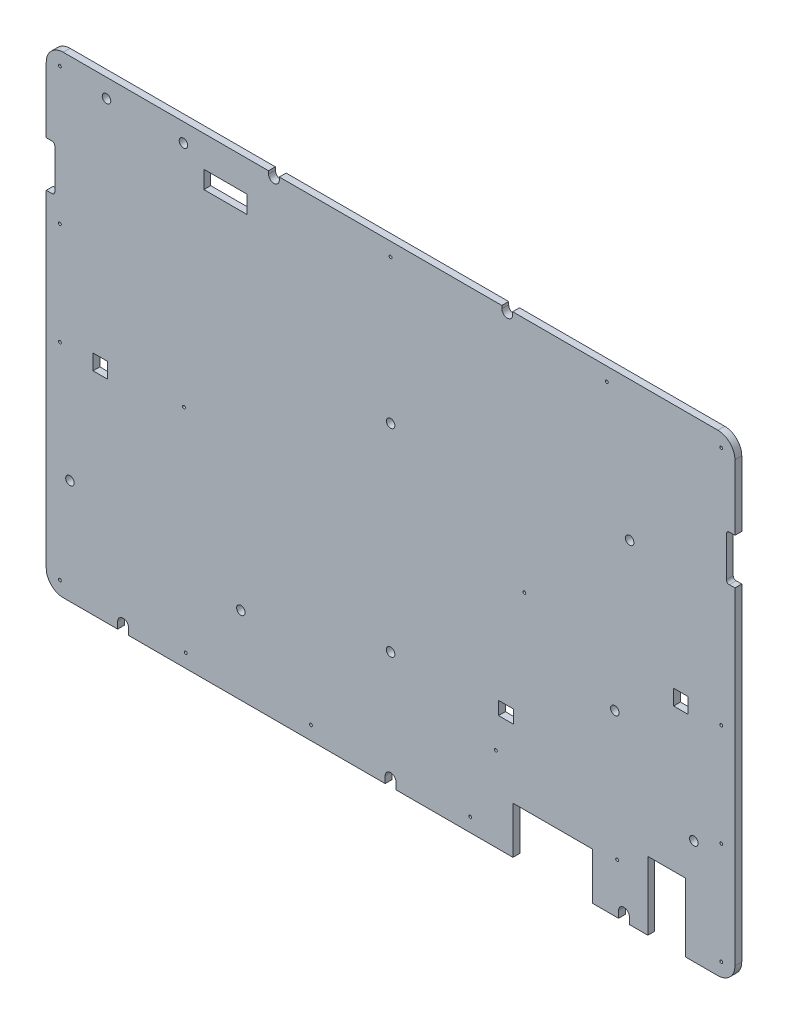
from build123d import *

# Parameters (mm, degrees)
SKIZZE1_W                        = 121
SKIZZE1_H                        = 83
AUFSATZ_LINEAR_AUSTRAGEN1_DEPTH  = 1.2
SKIZZE2_R                        = 0.75
SKIZZE2_W                        = 14
SKIZZE2_H                        = 8.25
SKIZZE2_W_2                      = 2.55
SKIZZE2_H_2                      = 2.71
SKIZZE2_W_3                      = 6.6
SKIZZE2_H_3                      = 12
SKIZZE2_W_4                      = 7.6
SKIZZE2_H_4                      = 3.09
SKIZZE2_W_5                      = 2.6
SKIZZE2_H_5                      = 2.314480995
SCHNITT_LINEAR_AUSTRAGEN1_DEPTH  = 105.747028597
F_0_5_0_5_DURCHMESSER_BOHRUNG1_D = 0.5
VERRUNDUNG1_R                    = 3
SCHNITT_LINEAR_AUSTRAGEN2_DEPTH  = 105.747028597
SKIZZE8_W                        = 3.801252581
SKIZZE8_H                        = 8
SKIZZE8_W_2                      = 2.67743865
SCHNITT_LINEAR_AUSTRAGEN3_DEPTH  = 105.747028597
VERRUNDUNG2_R                    = 0.5


with BuildPart() as part:
    # Skizze1 → Aufsatz-Linear austragen1 (new body)
    with BuildSketch(Plane.XY):
        with Locations((0, 44)):
            Rectangle(SKIZZE1_W, SKIZZE1_H)
    extrude(amount=AUFSATZ_LINEAR_AUSTRAGEN1_DEPTH)

    # Skizze2 → Schnitt-Linear austragen1 (cut, through all)
    with BuildSketch(Plane.XY):
        with Locations((42, 61)):
            Circle(SKIZZE2_R)
        with Locations((0, 57.8)):
            Circle(SKIZZE2_R)
        with Locations((0, 23)):
            Circle(SKIZZE2_R)
        with Locations((39.4, 33.8)):
            Circle(SKIZZE2_R)
        with Locations((-26.3, 16.2)):
            Circle(SKIZZE2_R)
        with Locations((-36.389998649, 82.246892958)):
            Circle(SKIZZE2_R)
        with Locations((-49.909999351, 82.246892958)):
            Circle(SKIZZE2_R)
        with Locations((-56.333799461, 20.907941573)):
            Circle(SKIZZE2_R)
        with Locations((53.283097528, 20.907941573)):
            Circle(SKIZZE2_R)
        with Locations((28.5, 6.625)):
            Rectangle(SKIZZE2_W, SKIZZE2_H)
        with Locations((-51, 41)):
            Rectangle(SKIZZE2_W_2, SKIZZE2_H_2)
        with Locations((51, 41)):
            Rectangle(SKIZZE2_W_2, SKIZZE2_H_2)
        with Locations((48.5, 8.5)):
            Rectangle(SKIZZE2_W_3, SKIZZE2_H_3)
        with Locations((-29, 78.5)):
            Rectangle(SKIZZE2_W_4, SKIZZE2_H_4)
        with Locations((20.261326432, 23.962336547)):
            Rectangle(SKIZZE2_W_5, SKIZZE2_H_5)
    extrude(amount=SCHNITT_LINEAR_AUSTRAGEN1_DEPTH, mode=Mode.SUBTRACT)

    # Ø0.5 (0.5) Durchmesser Bohrung1 (through all)
    with Locations(Plane(origin=(0, 0, 0), x_dir=(1, 0, 0), z_dir=(0, 0, -1))):
        with Locations((58.1, -83.1), (38, -83.1), (0, -83.1), (-58.1, -83.1), (-58.1, -59.1), (-58.1, -41.1), (-36.3, -42.1), (-58.1, -4.9), (-36, -4.9), (-14, -4.9), (14, -4.9), (58.1, -4.9), (39.8, -11.3), (58.1, -40.9), (58.1, -22.9), (23.5, -43.8), (18.5, -17.3)):
            Hole(F_0_5_0_5_DURCHMESSER_BOHRUNG1_D / 2)

    # Verrundung1
    verrundung1_edges = [part.edges().sort_by_distance(p)[0] for p in [
        (-60.5, 2.5, 0.6),
        (-60.5, 85.5, 0.6),
        (60.5, 85.5, 0.6),
        (60.5, 2.5, 0.6),
    ]]
    fillet(verrundung1_edges, radius=VERRUNDUNG1_R)

    # Skizze7 → Schnitt-Linear austragen2 (cut, through all)
    with BuildSketch(Plane.XY):
        with BuildLine():
            Line((19.55, 85), (19.55, 87.452976337))
            ThreePointArc((19.55, 87.452976337), (20.5, 88.402976337), (21.45, 87.452976337))
            Line((21.45, 87.452976337), (21.45, 85))
            ThreePointArc((21.45, 85), (20.5, 84.05), (19.55, 85))
        make_face()
        with BuildLine():
            Line((-21.45, 85), (-21.45, 88.302996714))
            ThreePointArc((-21.45, 88.302996714), (-20.5, 89.252996714), (-19.55, 88.302996714))
            Line((-19.55, 88.302996714), (-19.55, 85))
            ThreePointArc((-19.55, 85), (-20.5, 84.05), (-21.45, 85))
        make_face()
        with BuildLine():
            Line((41.95, 3.7), (41.95, -5.660796072))
            ThreePointArc((41.95, -5.660796072), (41, -6.610796072), (40.05, -5.660796072))
            Line((40.05, -5.660796072), (40.05, 3.7))
            ThreePointArc((40.05, 3.7), (41, 4.65), (41.95, 3.7))
        make_face()
        with BuildLine():
            Line((0.95, 3.7), (0.95, -1.929493841))
            ThreePointArc((0.95, -1.929493841), (0, -2.879493841), (-0.95, -1.929493841))
            Line((-0.95, -1.929493841), (-0.95, 3.7))
            ThreePointArc((-0.95, 3.7), (0, 4.65), (0.95, 3.7))
        make_face()
        with BuildLine():
            Line((-46.05, 3.7), (-46.05, -0.870122008))
            ThreePointArc((-46.05, -0.870122008), (-47, -1.820122008), (-47.95, -0.870122008))
            Line((-47.95, -0.870122008), (-47.95, 3.7))
            ThreePointArc((-47.95, 3.7), (-47, 4.65), (-46.05, 3.7))
        make_face()
    extrude(amount=SCHNITT_LINEAR_AUSTRAGEN2_DEPTH, mode=Mode.SUBTRACT)

    # Skizze8 → Schnitt-Linear austragen3 (cut, through all)
    with BuildSketch(Plane.XY):
        with Locations((-60.900626291, 67)):
            Rectangle(SKIZZE8_W, SKIZZE8_H)
        with Locations((60.338719325, 67)):
            Rectangle(SKIZZE8_W_2, SKIZZE8_H)
    extrude(amount=SCHNITT_LINEAR_AUSTRAGEN3_DEPTH, mode=Mode.SUBTRACT)

    # Verrundung2
    verrundung2_edges = [part.edges().sort_by_distance(p)[0] for p in [
        (-59, 71, 0.6),
        (-59, 63, 0.6),
        (59, 63, 0.6),
        (59, 71, 0.6),
    ]]
    fillet(verrundung2_edges, radius=VERRUNDUNG2_R)


solid = part.part
